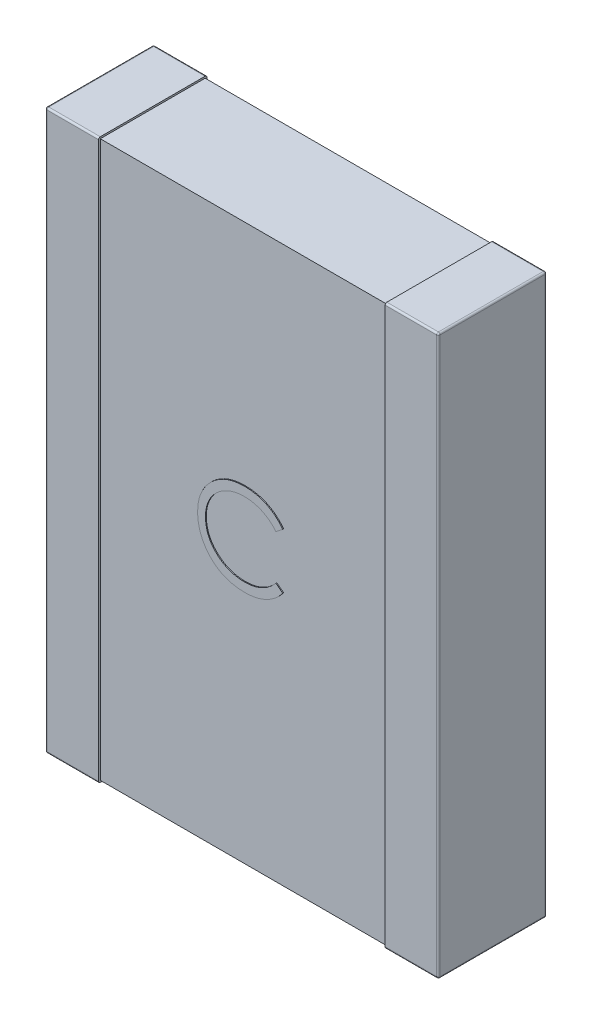
from build123d import *

# Parameters (mm, degrees)
EXTRUDE_1_DEPTH        = 1.22
EXTRUDE_1_DEPTH_BACK   = 0.02
SKETCH_3_W             = 0.61
SKETCH_3_H             = 6.4
EXTRUDE_1_2_DEPTH      = 1.22
EXTRUDE_1_2_DEPTH_BACK = 0.02
SKETCH_5_W             = 1.2
SKETCH_5_H             = 6.36
EXTRUDE_3_DEPTH        = 1.66
FILLET_3_R             = 0.02
EXTRUDE_4_DEPTH        = 0.01


with BuildPart() as part:
    # 草图3 → 凸台-拉伸1 (new, two sides: drawn at the far end of the back side and taken through both)
    with BuildSketch(Plane.XY.offset(-EXTRUDE_1_DEPTH_BACK)):
        with Locations((-1.945, 0)):
            Rectangle(SKETCH_3_W, SKETCH_3_H)
    extrude(amount=EXTRUDE_1_DEPTH + EXTRUDE_1_DEPTH_BACK)



with BuildPart() as body_2:
    # 草图3 → Extrude 1 2 (new, two sides: drawn at the far end of the back side and taken through both)
    with BuildSketch(Plane.XY.offset(-EXTRUDE_1_2_DEPTH_BACK)):
        with Locations((1.945, 0)):
            Rectangle(SKETCH_3_W, SKETCH_3_H)
    extrude(amount=EXTRUDE_1_2_DEPTH + EXTRUDE_1_2_DEPTH_BACK)


with BuildPart() as part_1:
    add(part.part)

    add(body_2.part)  # 凸台-拉伸3 merges body 2
    # 草图5 → 凸台-拉伸3 (add, symmetric)
    with BuildSketch(Plane(origin=(0, 0, 0), x_dir=(0, 0, -1), z_dir=(1, 0, 0))):
        with Locations((-0.6, 0)):
            Rectangle(SKETCH_5_W, SKETCH_5_H)
    extrude(amount=EXTRUDE_3_DEPTH, both=True)

    # 圆角3
    fillet_3_edges = [part_1.edges().sort_by_distance(p)[0] for p in [
        (-2.25, 0, -0.02),
        (-1.945, 3.2, 1.22),
        (-1.945, -3.2, -0.02),
        (-2.25, 0, 1.22),
        (-1.945, -3.2, 1.22),
        (2.25, 3.2, 0.6),
        (2.25, 0, -0.02),
        (2.25, -3.2, 0.6),
        (1.945, -3.2, -0.02),
        (1.945, 3.2, -0.02),
        (2.25, 0, 1.22),
        (1.945, 3.2, 1.22),
        (1.945, -3.2, 1.22),
        (-1.945, 3.2, -0.02),
        (-2.25, -3.2, 0.6),
        (-2.25, 3.2, 0.6),
    ]]
    fillet(fillet_3_edges, radius=FILLET_3_R)

    # 草图6 → 凸台-拉伸4 (add)
    with BuildSketch(Plane.XY.offset(1.2)):
        with BuildLine():
            Line((0.458404382, 0.361329361), (0.379878741, 0.301233207))
            add(Edge.make_bspline(
                [(0.379878741, 0.301233207), (0.374277059, 0.307909199), (0.363149217, 0.321171175), (0.345246588, 0.339793902), (0.326588975, 0.357241119), (0.307183512, 0.373595942), (0.286680907, 0.388286446), (0.265577821, 0.40207819), (0.243521237, 0.414440401), (0.213020741, 0.429429826), (0.173121356, 0.445071584), (0.122894259, 0.458186793), (0.070462517, 0.4665357), (0.034691774, 0.467439941), (0.016497331, 0.467899874)],
                knots=[0, 0, 0, 0, 0.757959112, 1.505699292, 2.245454638, 2.979532153, 3.711538275, 4.438200793, 5.171680507, 5.909471876, 7.393775596, 8.890124382, 10.418191784, 12, 12, 12, 12], degree=3))
            add(Edge.make_bspline(
                [(0.016497331, 0.467899874), (0.006473531, 0.467784456), (-0.013481038, 0.467554692), (-0.043094888, 0.464523513), (-0.072155759, 0.460263167), (-0.10064475, 0.453941646), (-0.128525595, 0.445949469), (-0.155980567, 0.436399351), (-0.182612167, 0.424583683), (-0.208788806, 0.41152418), (-0.233868581, 0.396773481), (-0.257598595, 0.380683952), (-0.2798923, 0.363435639), (-0.300767332, 0.344963894), (-0.320245031, 0.325351906), (-0.338184263, 0.304390665), (-0.354522952, 0.282147187), (-0.369584959, 0.258914785), (-0.383074311, 0.23476113), (-0.394368562, 0.209596824), (-0.404370026, 0.183852795), (-0.412284095, 0.157238177), (-0.418548243, 0.129940244), (-0.422870432, 0.101885733), (-0.425867138, 0.073133254), (-0.42609576, 0.053644879), (-0.426211002, 0.043821348)],
                knots=[0, 0, 0, 0, 1.054917814, 2.100044995, 3.131103042, 4.146048494, 5.169673617, 6.183595914, 7.203665975, 8.234915748, 9.262203917, 10.264457458, 11.251630812, 12.227803204, 13.197192746, 14.159520551, 15.12972552, 16.100847026, 17.073214652, 18.039054194, 19.002613845, 19.979014051, 20.95965708, 21.949030935, 22.966165397, 24, 24, 24, 24], degree=3))
            add(Edge.make_bspline(
                [(-0.426211002, 0.043821348), (-0.425850483, 0.029040971), (-0.42514265, 2.1661e-05), (-0.418843126, -0.042484227), (-0.409270243, -0.08320442), (-0.394922935, -0.121884375), (-0.377231778, -0.159001049), (-0.354877317, -0.193926435), (-0.328986878, -0.227188311), (-0.299194187, -0.258000582), (-0.266506811, -0.28614736), (-0.231435979, -0.310933241), (-0.194069039, -0.331594636), (-0.154818574, -0.348787763), (-0.113382541, -0.362003971), (-0.069835455, -0.371308006), (-0.024272027, -0.377377201), (0.006862087, -0.377958255), (0.022707267, -0.378253972)],
                knots=[0, 0, 0, 0, 1.029171465, 2.020641659, 2.987623507, 3.938342917, 4.889210282, 5.84687017, 6.821220943, 7.821438502, 8.827599549, 9.822697543, 10.807740252, 11.797342354, 12.80366471, 13.83203677, 14.896651826, 16, 16, 16, 16], degree=3))
            add(Edge.make_bspline(
                [(0.022707267, -0.378253972), (0.040165178, -0.377771464), (0.074526524, -0.376821771), (0.124917388, -0.368776272), (0.173156178, -0.355731152), (0.219245489, -0.337474603), (0.263055388, -0.313741664), (0.304654434, -0.284970842), (0.344077739, -0.250888461), (0.36778382, -0.22486471), (0.379878741, -0.211587305)],
                knots=[0, 0, 0, 0, 1.028121516, 2.023589091, 2.998037872, 3.967518031, 4.937445131, 5.927275754, 6.942489185, 8, 8, 8, 8], degree=3))
            Line((0.379878741, -0.211587305), (0.458404382, -0.271082498))
            add(Edge.make_bspline(
                [(0.458404382, -0.271082498), (0.452084922, -0.279236341), (0.439476272, -0.295504972), (0.419059696, -0.318439746), (0.397551897, -0.340012327), (0.374793123, -0.360048791), (0.351045182, -0.378950066), (0.325881664, -0.396179161), (0.299633369, -0.411976557), (0.272389232, -0.426441392), (0.2441782, -0.439274891), (0.215034076, -0.450261682), (0.185082483, -0.459725936), (0.154322052, -0.467512204), (0.122688979, -0.473589656), (0.090297415, -0.477652421), (0.05707745, -0.480435825), (0.034665616, -0.480689515), (0.023308229, -0.480818075)],
                knots=[0, 0, 0, 0, 0.986787822, 1.968848986, 2.935600012, 3.899624008, 4.868462664, 5.837806735, 6.815139263, 7.798259679, 8.787526145, 9.778297419, 10.776456485, 11.791383307, 12.812564526, 13.85620153, 14.913611965, 16, 16, 16, 16], degree=3))
            add(Edge.make_bspline(
                [(0.023308229, -0.480818075), (0.012552895, -0.48074322), (-0.008714445, -0.480595203), (-0.040114088, -0.478197441), (-0.07068254, -0.474926088), (-0.100332433, -0.470000336), (-0.129225569, -0.464187667), (-0.157100021, -0.45639588), (-0.184230082, -0.447667546), (-0.21050675, -0.437408979), (-0.235952379, -0.425832927), (-0.260484896, -0.412749624), (-0.28409302, -0.398269091), (-0.307008854, -0.382710517), (-0.328893878, -0.365574145), (-0.349937743, -0.347097964), (-0.37025845, -0.327344246), (-0.382830646, -0.313100002), (-0.389151707, -0.305938267)],
                knots=[0, 0, 0, 0, 1.114604814, 2.203992996, 3.262667896, 4.300477797, 5.318619304, 6.316056647, 7.298880507, 8.271930387, 9.238335007, 10.195173496, 11.151986948, 12.108099108, 13.064862484, 14.031167946, 15.010108607, 16, 16, 16, 16], degree=3))
            add(Edge.make_bspline(
                [(-0.389151707, -0.305938267), (-0.399276177, -0.293497927), (-0.419402885, -0.268767439), (-0.44515308, -0.22868573), (-0.467195239, -0.18683767), (-0.48501693, -0.143003405), (-0.49894914, -0.097281294), (-0.50860091, -0.04964829), (-0.514872797, -0.000148878), (-0.515590022, 0.033518776), (-0.515954592, 0.050632246)],
                knots=[0, 0, 0, 0, 0.994628077, 1.977248131, 2.950237994, 3.925870899, 4.908910175, 5.911660606, 6.938484602, 8, 8, 8, 8], degree=3))
            add(Edge.make_bspline(
                [(-0.515954592, 0.050632246), (-0.515510251, 0.068619518), (-0.514636038, 0.104008354), (-0.507208668, 0.155943769), (-0.49526044, 0.205701312), (-0.478289901, 0.253188096), (-0.456774086, 0.29865389), (-0.430195053, 0.341751377), (-0.398861584, 0.382756177), (-0.363019422, 0.421046106), (-0.323714469, 0.45605735), (-0.281623379, 0.486859122), (-0.236828537, 0.512492698), (-0.189823437, 0.533920173), (-0.140256099, 0.55039002), (-0.08823228, 0.561919502), (-0.033849732, 0.569095821), (0.003253818, 0.570003023), (0.022106305, 0.570463977)],
                knots=[0, 0, 0, 0, 1.032925535, 2.032216505, 3.007276963, 3.968222605, 4.92396291, 5.891752235, 6.871517503, 7.883894988, 8.900124299, 9.891468569, 10.874487609, 11.85992873, 12.854644235, 13.869047385, 14.917252991, 16, 16, 16, 16], degree=3))
            add(Edge.make_bspline(
                [(0.022106305, 0.570463977), (0.033596155, 0.570326223), (0.056339154, 0.570053553), (0.089982769, 0.567394655), (0.122737719, 0.562962196), (0.154626571, 0.556929034), (0.185804462, 0.549441228), (0.216033102, 0.539686857), (0.24548987, 0.528533562), (0.273988986, 0.515688286), (0.301393715, 0.501269217), (0.32769552, 0.485436182), (0.35268548, 0.468208809), (0.376539436, 0.449733616), (0.398858354, 0.429619742), (0.420275919, 0.408420428), (0.440064799, 0.38552505), (0.452279997, 0.369409355), (0.458404382, 0.361329361)],
                knots=[0, 0, 0, 0, 1.096760587, 2.17092713, 3.219439832, 4.250915756, 5.268269357, 6.278326846, 7.281116186, 8.274029601, 9.260640565, 10.235837813, 11.203064059, 12.156899882, 13.114053108, 14.069676657, 15.032185724, 16, 16, 16, 16], degree=3))
        make_face()
    extrude(amount=EXTRUDE_4_DEPTH)


solid = part_1.part
